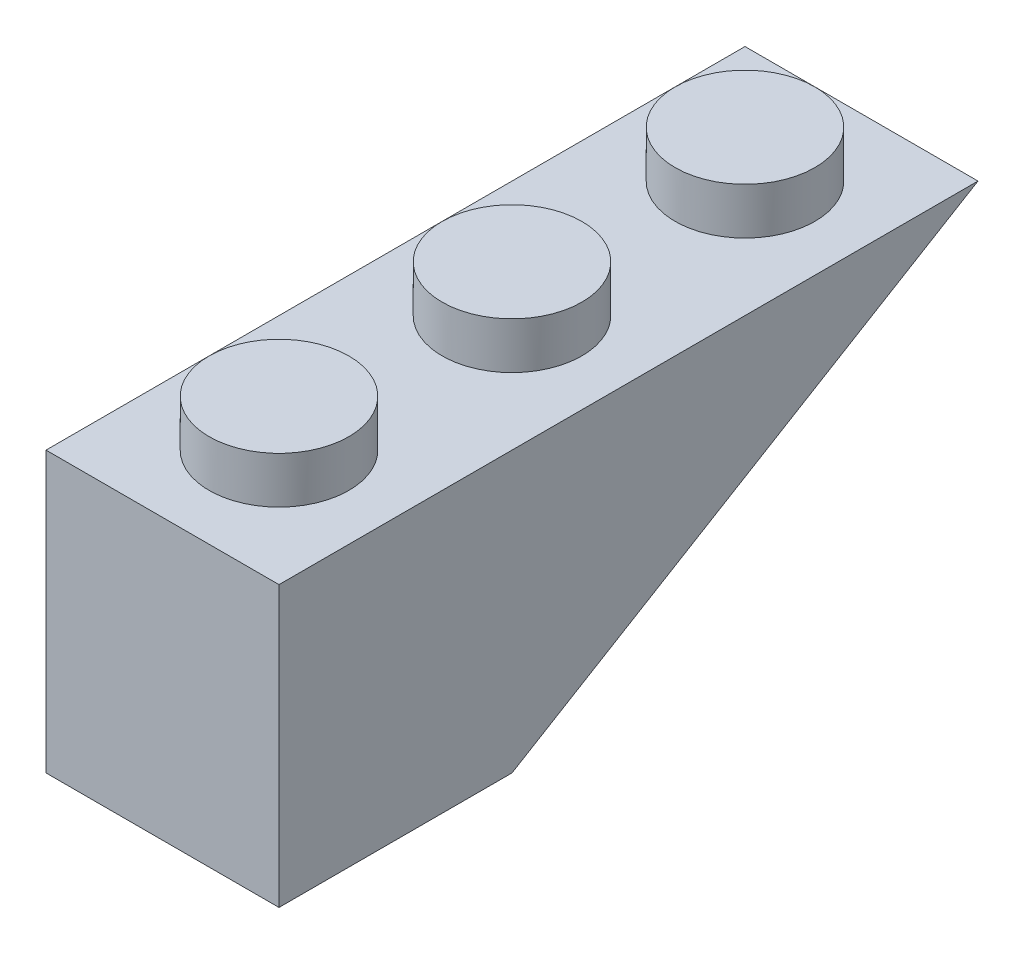
from build123d import *

# Parameters (mm, degrees)
SKETCH1_W           = 8
SKETCH1_H           = 9.6
BOSS_EXTRUDE1_DEPTH = 8
SHELL2_T            = -1.6
BOSS_EXTRUDE3_DEPTH = 8
SKETCH4_R           = 2.4
BOSS_EXTRUDE4_DEPTH = 1.6
LPATTERN2_COUNT     = 3
LPATTERN2_PITCH     = 8


with BuildPart() as part:
    # Sketch1 → Boss-Extrude1 (new body)
    with BuildSketch(Plane(origin=(0, 0, 0), x_dir=(0, 0, -1), z_dir=(1, 0, 0))):
        with Locations((4, 4.8)):
            Rectangle(SKETCH1_W, SKETCH1_H)
    extrude(amount=BOSS_EXTRUDE1_DEPTH)

    # Shell2
    shell2_openings = [part.faces().sort_by_distance(p)[0] for p in [
        (4, 0, -4),
    ]]
    offset(amount=SHELL2_T, openings=shell2_openings, kind=Kind.INTERSECTION)

    # Sketch3 → Boss-Extrude3 (add)
    with BuildSketch(Plane(origin=(0, 0, 0), x_dir=(0, 0, -1), z_dir=(1, 0, 0))):
        Polygon((8, 0), (24, 9.6), (8, 9.6), align=None)
    extrude(amount=BOSS_EXTRUDE3_DEPTH)

    # Sketch4 → Boss-Extrude4 (add)
    with BuildSketch(Plane(origin=(0, 9.6, 0), x_dir=(1, 0, 0), z_dir=(0, 1, 0))):
        with Locations(Location((4, 4, 0), (0, 0, 90))):
            Circle(SKETCH4_R)
    boss_extrude4 = extrude(amount=BOSS_EXTRUDE4_DEPTH)

    # LPattern2: Boss-Extrude4 ×3
    with Locations(*[(0, 0, -i * LPATTERN2_PITCH) for i in range(1, LPATTERN2_COUNT)]):
        add(boss_extrude4)


solid = part.part
